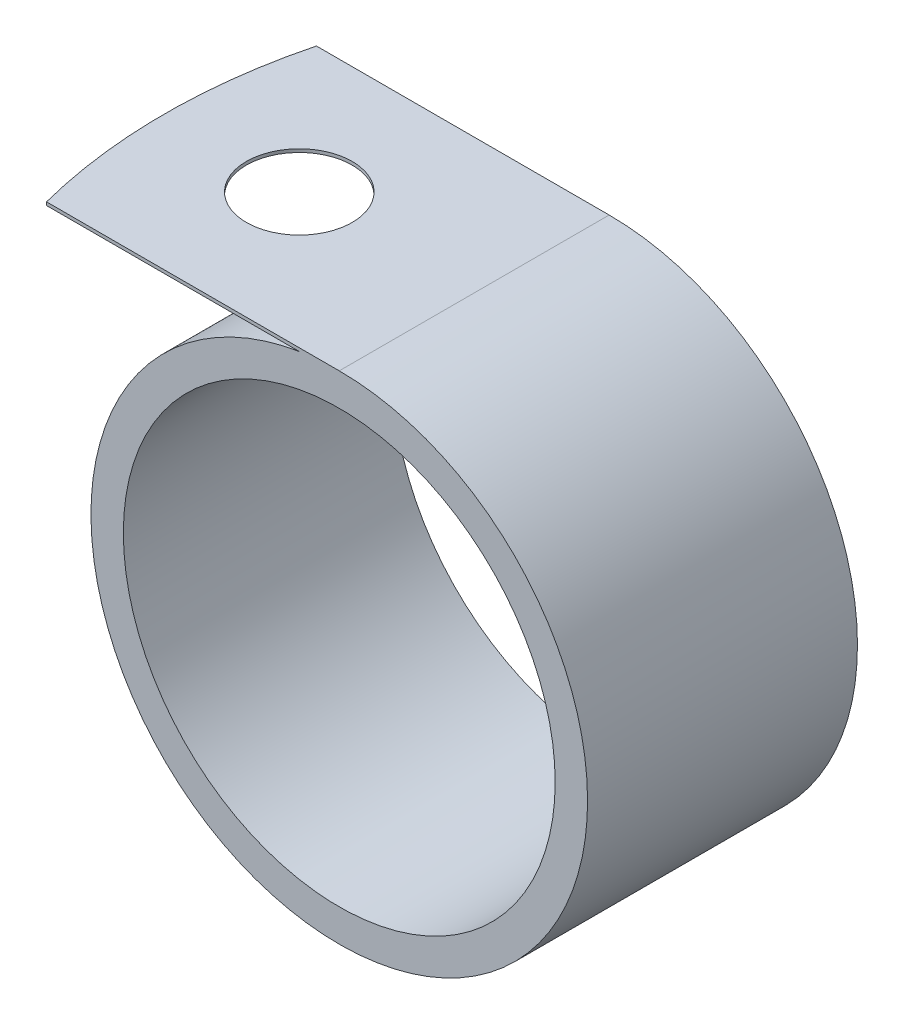
from build123d import *

# Parameters (mm, degrees)
SKETCH1_R           = 10.16
BOSS_EXTRUDE1_DEPTH = 6.35
CUT_EXTRUDE1_REACH  = 30.266
SKETCH2_R           = 2.4892


with BuildPart() as part:
    # Sketch1 → Boss-Extrude1 (new, symmetric)
    with BuildSketch(Plane.XY):
        with BuildLine():
            Line((0, 11.684), (-14.580972472, 11.684))
            Line((-14.580972472, 11.684), (-14.580972472, 11.5316))
            Line((-14.580972472, 11.5316), (-1.880972472, 11.5316))
            ThreePointArc((-1.880972472, 11.5316), (0.943568122, -11.645837677), (0, 11.684))
        make_face()
        Circle(SKETCH1_R, mode=Mode.SUBTRACT)
    extrude(amount=BOSS_EXTRUDE1_DEPTH, both=True)

    # Sketch2 → Cut-Extrude1 (cut, up to next)
    with BuildSketch(Plane(origin=(0, 11.684, 0), x_dir=(1, 0, 0), z_dir=(0, 1, 0)), mode=Mode.PRIVATE) as cut_extrude1_sk1:
        with Locations(Location((-8.230972472, 0, 0), (0, 0, 180))):
            Circle(SKETCH2_R)
    cut_extrude1_tool1 = extrude(cut_extrude1_sk1.sketch, amount=-CUT_EXTRUDE1_REACH, mode=Mode.PRIVATE) & part.part
    # Sketch2 → Cut-Extrude1 (cut, up to next)
    with BuildSketch(Plane(origin=(0, 11.684, 0), x_dir=(1, 0, 0), z_dir=(0, 1, 0)), mode=Mode.PRIVATE) as cut_extrude1_sk2:
        with BuildLine():
            ThreePointArc((-14.580972472, 0), (-14.378526757, 3.200509029), (-13.77441672, 6.35))
            Line((-13.77441672, 6.35), (-14.580972472, 6.35))
            Line((-14.580972472, 6.35), (-14.580972472, 0))
        make_face()
    cut_extrude1_tool2 = extrude(cut_extrude1_sk2.sketch, amount=-CUT_EXTRUDE1_REACH, mode=Mode.PRIVATE) & part.part
    # Sketch2 → Cut-Extrude1 (cut, up to next)
    with BuildSketch(Plane(origin=(0, 11.684, 0), x_dir=(1, 0, 0), z_dir=(0, 1, 0)), mode=Mode.PRIVATE) as cut_extrude1_sk3:
        with BuildLine():
            ThreePointArc((-13.77441672, -6.35), (-14.378526757, -3.200509029), (-14.580972472, 0))
            Line((-14.580972472, 0), (-14.580972472, -6.35))
            Line((-14.580972472, -6.35), (-13.77441672, -6.35))
        make_face()
    cut_extrude1_tool3 = extrude(cut_extrude1_sk3.sketch, amount=-CUT_EXTRUDE1_REACH, mode=Mode.PRIVATE) & part.part
    add(cut_extrude1_tool1.solids().sort_by_distance((-8.230972, 11.684, 0))[0], mode=Mode.SUBTRACT)
    add(cut_extrude1_tool2.solids().sort_by_distance((-14.339679, 11.684, -4.767585))[0], mode=Mode.SUBTRACT)
    add(cut_extrude1_tool3.solids().sort_by_distance((-14.339679, 11.684, 4.767585))[0], mode=Mode.SUBTRACT)


solid = part.part
